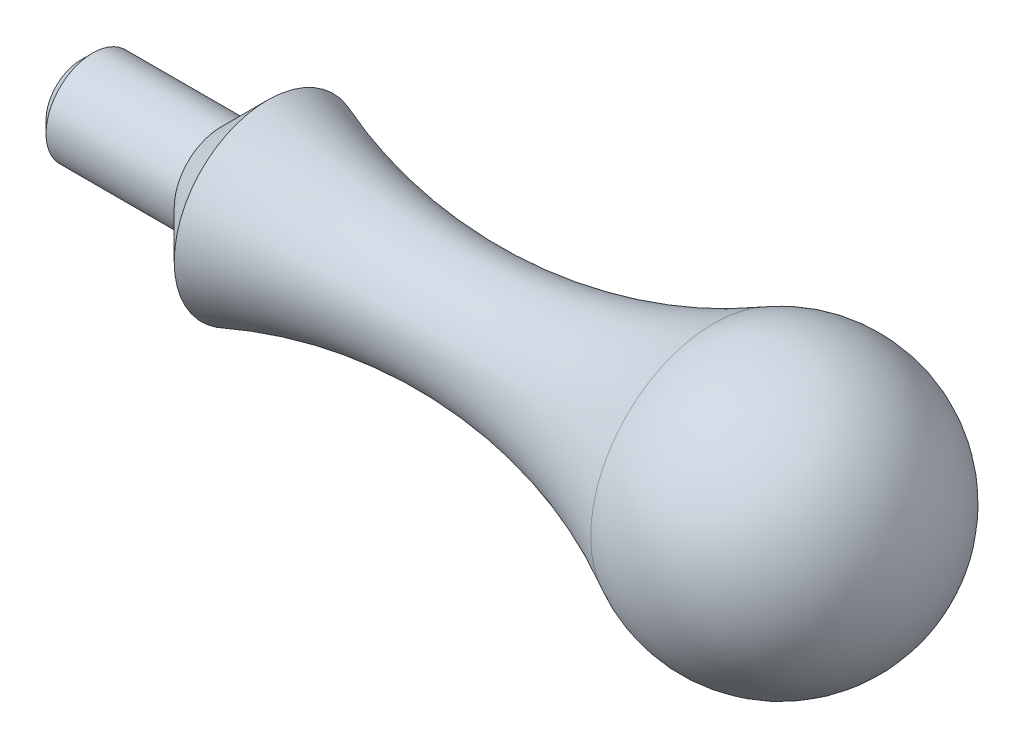
from build123d import *

# Parameters (mm, degrees)
CHAMFER1_SIZE = 0.79375


with BuildPart() as part:
    # Sketch1 → Revolve1 (revolve)
    with BuildSketch(Plane.XY, mode=Mode.PRIVATE) as revolve1_sk:
        with BuildLine():
            Line((0, 0), (0, 3.175))
            Line((0, 3.175), (9.525, 3.175))
            Line((9.525, 3.175), (12.7, 6.35))
            ThreePointArc((12.7, 6.35), (28.116951976, 4.049849888), (43.091857, 8.377125972))
            ThreePointArc((43.091857, 8.377125972), (52.50083008, 8.182414438), (57.15, 0))
            Line((57.15, 0), (0, 0))
        make_face()
    revolve(revolve1_sk.sketch.rotate(Axis((-4.006160507, 0, 0), (1, 0, 0)), 90), axis=Axis((-4.006160507, 0, 0), (1, 0, 0)))

    # Chamfer1
    chamfer1_edges = [part.edges().sort_by_distance(p)[0] for p in [
        (0, 0, -3.175),
    ]]
    chamfer(chamfer1_edges, length=CHAMFER1_SIZE)


solid = part.part
